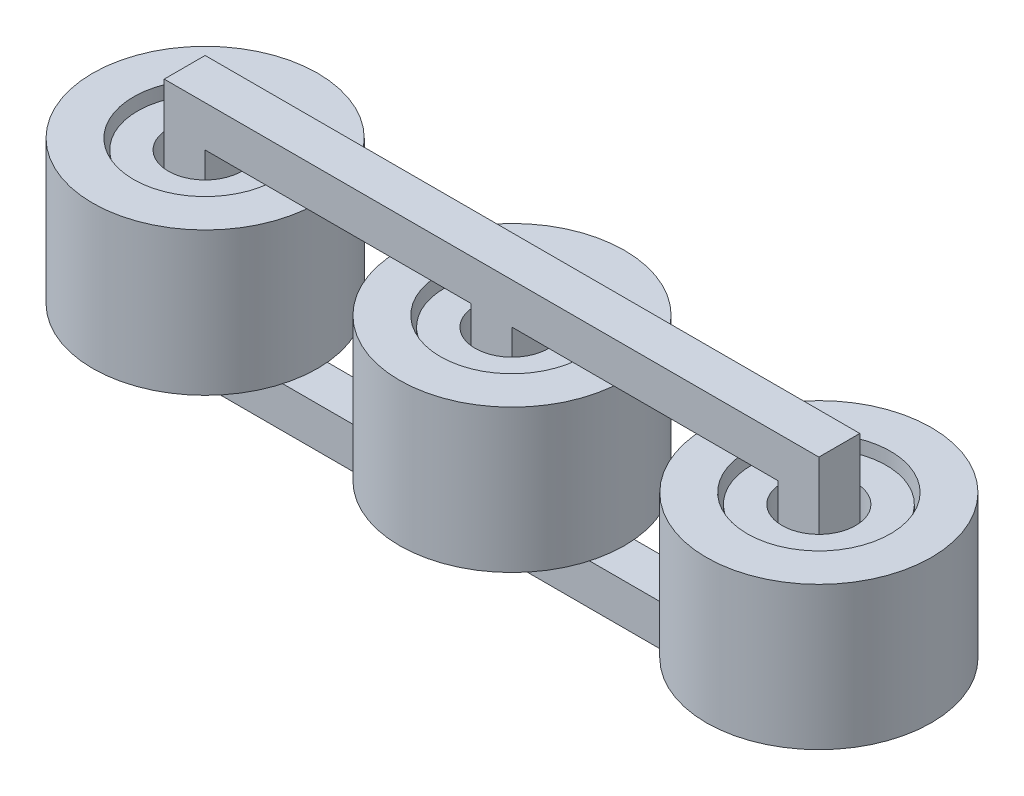
from build123d import *

# Parameters (mm, degrees)
SKETCH2_W           = 1700
SKETCH2_H           = 1200
SKETCH2_W_2         = 1300
SKETCH2_H_2         = 800
BOSS_EXTRUDE1_DEPTH = 100
SKETCH4_W           = 150
SKETCH4_H           = 600
SKETCH5_W           = 200
SKETCH5_H           = 700
LPATTERN2_COUNT     = 2
LPATTERN2_PITCH     = 1500


with BuildPart() as part:
    # Sketch2 → Boss-Extrude1 (new, symmetric)
    with BuildSketch(Plane.XY):
        with Locations((-750, 0)):
            Rectangle(SKETCH2_W, SKETCH2_H)
        with Locations((-750, 0)):
            Rectangle(SKETCH2_W_2, SKETCH2_H_2, mode=Mode.SUBTRACT)
    boss_extrude1 = extrude(amount=BOSS_EXTRUDE1_DEPTH, both=True)

    # Mirror3: Boss-Extrude1 across plane
    add(boss_extrude1.mirror(Plane(origin=(0, 0, 0), x_dir=(0, 0, 1), z_dir=(1, 0, 0))))


with BuildPart() as body_2:
    # Sketch4 → Primary winding (revolve)
    with BuildSketch(Plane.XY, mode=Mode.PRIVATE) as primary_winding_sk:
        with Locations((255, 0)):
            Rectangle(SKETCH4_W, SKETCH4_H)
    revolve(primary_winding_sk.sketch.rotate(Axis((0, 717.90022001, 0), (0, -1, 0)), 90), axis=Axis((0, 717.90022001, 0), (0, -1, 0)))


with BuildPart() as body_3:
    # Sketch5 → Secondary winding (revolve)
    with BuildSketch(Plane.XY, mode=Mode.PRIVATE) as secondary_winding_sk:
        with Locations((450, 0)):
            Rectangle(SKETCH5_W, SKETCH5_H)
    revolve(secondary_winding_sk.sketch.rotate(Axis((0, 717.90022001, 0), (0, -1, 0)), 90), axis=Axis((0, 717.90022001, 0), (0, -1, 0)))


with BuildPart() as lpattern2_1:
    # LPattern2: pattern copy
    add(body_2.part.moved(Location(Vector(-1, 0, 0) * (1 * LPATTERN2_PITCH))))


with BuildPart() as lpattern2_2:
    # LPattern2: pattern copy
    add(body_3.part.moved(Location(Vector(-1, 0, 0) * (1 * LPATTERN2_PITCH))))


with BuildPart() as body_6:
    # Mirror4: mirrored copy
    add(lpattern2_2.part.mirror(Plane(origin=(0, 0, 0), x_dir=(0, 0, 1), z_dir=(1, 0, 0))))


with BuildPart() as body_7:
    # Mirror4 2: mirrored copy
    add(lpattern2_1.part.mirror(Plane(origin=(0, 0, 0), x_dir=(0, 0, 1), z_dir=(1, 0, 0))))


solid = Compound([part.part, body_2.part, body_3.part, lpattern2_1.part, lpattern2_2.part, body_6.part, body_7.part])
